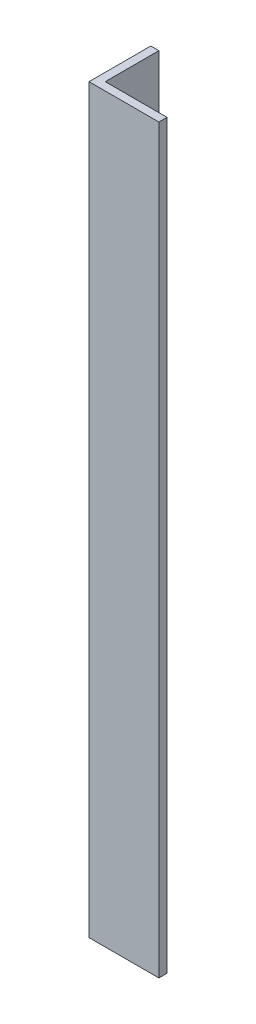
from build123d import *

# Parameters (mm, degrees)
BOSS_EXTRUDE1_DEPTH = 457.2


with BuildPart() as part:
    # Sketch1 → Boss-Extrude1 (new body)
    with BuildSketch(Plane(origin=(0, 0, 0), x_dir=(1, 0, 0), z_dir=(0, 1, 0))):
        Polygon((0, 0), (-5, 0), (-5, 38.1), (0, 38.1), (0, 5), (38.1, 5), (38.1, 0), align=None)
    extrude(amount=BOSS_EXTRUDE1_DEPTH)


solid = part.part
